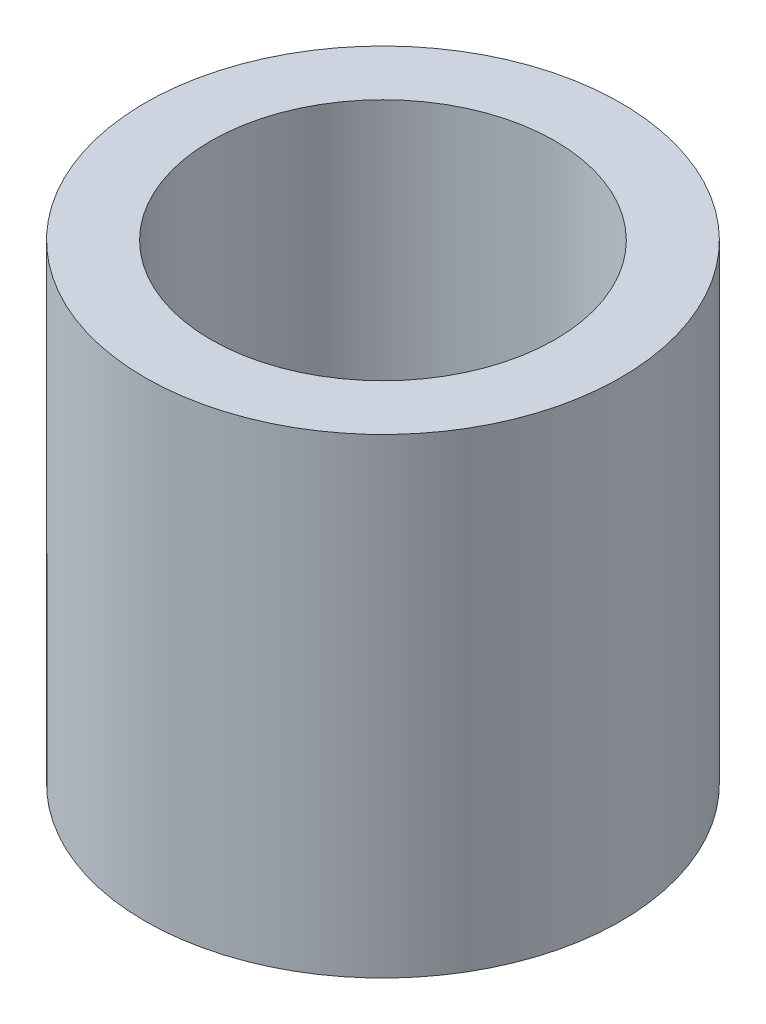
from build123d import *

# Parameters (mm, degrees)
ESQUISSE2_R        = 2.35
ESQUISSE2_R_2      = 1.7
BOSS_EXTRU_1_DEPTH = 4.65


with BuildPart() as part:
    # Esquisse2 → Boss.-Extru.1 (new body)
    with BuildSketch(Plane(origin=(0, 0, 0), x_dir=(1, 0, 0), z_dir=(0, 1, 0))):
        with Locations(Location((0, 0, 0), (0, 0, 270))):
            Circle(ESQUISSE2_R)
        with Locations(Location((0, 0, 0), (0, 0, 270))):
            Circle(ESQUISSE2_R_2, mode=Mode.SUBTRACT)
    extrude(amount=BOSS_EXTRU_1_DEPTH)


solid = part.part
